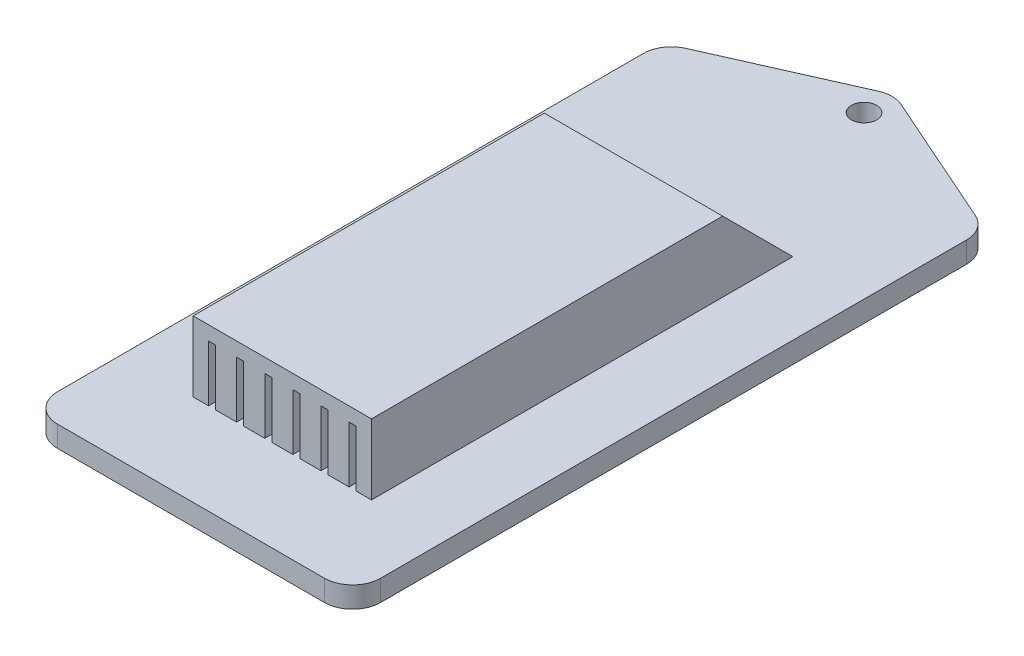
from build123d import *

# Parameters (mm, degrees)
SKETCH1_R                = 9
BOSS_EXTRUDE1_DEPTH      = 15
BOSS_EXTRUDE2_DEPTH      = 63.5
BOSS_EXTRUDE2_DEPTH_BACK = 63.5
CUT_EXTRUDE1_DEPTH       = 200
CUT_EXTRUDE1_DEPTH_BACK  = 200
SKETCH4_W                = 5
SKETCH4_H                = 40


with BuildPart() as part:
    # Sketch1 → Boss-Extrude1 (new body)
    with BuildSketch(Plane(origin=(0, 0, 0), x_dir=(1, 0, 0), z_dir=(0, 1, 0))):
        with BuildLine():
            Line((-115, 211.991055507), (-115, -205))
            ThreePointArc((-115, -205), (-109.142135624, -219.142135624), (-95, -225))
            Line((-95, -225), (95, -225))
            ThreePointArc((95, -225), (109.142135624, -219.142135624), (115, -205))
            Line((115, -205), (115, 211.991055507))
            ThreePointArc((115, 211.991055507), (111.765445383, 222.896092926), (103.108015888, 230.273836432))
            Line((103.108015888, 230.273836432), (8.108015888, 272.404271215))
            ThreePointArc((8.108015888, 272.404271215), (0, 274.12149029), (-8.108015888, 272.404271215))
            Line((-8.108015888, 272.404271215), (-103.108015888, 230.273836432))
            ThreePointArc((-103.108015888, 230.273836432), (-111.765445383, 222.896092926), (-115, 211.991055507))
        make_face()
        with Locations(Location((0, 254.12149029, 0), (0, 0, 270))):
            Circle(SKETCH1_R, mode=Mode.SUBTRACT)
    extrude(amount=BOSS_EXTRUDE1_DEPTH)

    # Sketch2 → Boss-Extrude2 (add, two sides: drawn at the far end of the back side and taken through both)
    with BuildSketch(Plane(origin=(0, 0, 0), x_dir=(0, 0, -1), z_dir=(1, 0, 0)).offset(-BOSS_EXTRUDE2_DEPTH_BACK)):
        Polygon((-160, 15), (-160, 65), (90, 65), (140, 15), align=None)
    extrude(amount=BOSS_EXTRUDE2_DEPTH + BOSS_EXTRUDE2_DEPTH_BACK)

    # Sketch4 → Cut-Extrude1 (cut, two sides: drawn at the far end of the back side and taken through both)
    with BuildSketch(Plane.XY.offset(-CUT_EXTRUDE1_DEPTH_BACK)):
        with Locations((-50, 35)):
            Rectangle(SKETCH4_W, SKETCH4_H)
        with Locations((50, 35)):
            Rectangle(SKETCH4_W, SKETCH4_H)
        with Locations((30, 35)):
            Rectangle(SKETCH4_W, SKETCH4_H)
        with Locations((10, 35)):
            Rectangle(SKETCH4_W, SKETCH4_H)
        with Locations((-10, 35)):
            Rectangle(SKETCH4_W, SKETCH4_H)
        with Locations((-30, 35)):
            Rectangle(SKETCH4_W, SKETCH4_H)
    extrude(amount=CUT_EXTRUDE1_DEPTH + CUT_EXTRUDE1_DEPTH_BACK, mode=Mode.SUBTRACT)


solid = part.part
